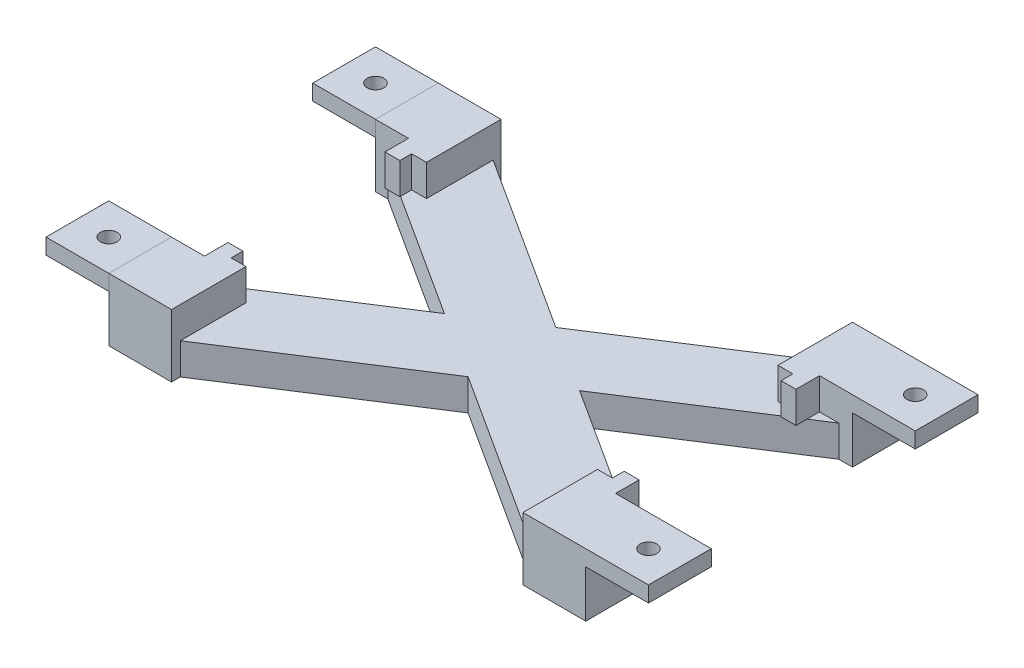
from build123d import *

# Parameters (mm, degrees)
SKETCH1_W                           = 20
SKETCH1_H                           = 20
BOSS_EXTRUDE1_DEPTH                 = 10
BOSS_EXTRUDE1_2_DEPTH               = 10
BOSS_EXTRUDE1_3_DEPTH               = 10
BOSS_EXTRUDE1_4_DEPTH               = 10
SKETCH1_3_W                         = 20
SKETCH1_3_H                         = 20
BOSS_EXTRUDE2_DEPTH                 = 10
BOSS_EXTRUDE3_DEPTH                 = 10
SKETCH3_W                           = 20
SKETCH3_H                           = 5
BOSS_EXTRUDE4_DEPTH                 = 20
BOSS_EXTRUDE4_2_DEPTH               = 20
BOSS_EXTRUDE6_DEPTH                 = 10
SKETCH10_W                          = 2.6543
SKETCH10_H                          = 20
F_4_0_209_DIAMETER_HOLE1_AT_2_COUNT = 2
F_4_0_209_DIAMETER_HOLE1_AT_2_PITCH = 172
F_4_0_209_DIAMETER_HOLE1_AT_3_COUNT = 2
F_4_0_209_DIAMETER_HOLE1_AT_3_PITCH = 191.85671737
F_4_0_209_DIAMETER_HOLE1_AT_4_COUNT = 2
F_4_0_209_DIAMETER_HOLE1_AT_4_PITCH = 85


with BuildPart() as part:
    # Sketch1 → Boss-Extrude1 (new body)
    with BuildSketch(Plane(origin=(0, 0, 0), x_dir=(1, 0, 0), z_dir=(0, 1, 0))):
        with Locations((-66, 42.5)):
            Rectangle(SKETCH1_W, SKETCH1_H)
    extrude(amount=BOSS_EXTRUDE1_DEPTH)



with BuildPart() as body_2:
    # Sketch1 → Boss-Extrude1 2 (new body)
    with BuildSketch(Plane(origin=(0, 0, 0), x_dir=(1, 0, 0), z_dir=(0, 1, 0))):
        with Locations((-66, -42.5)):
            Rectangle(SKETCH1_W, SKETCH1_H)
    extrude(amount=BOSS_EXTRUDE1_2_DEPTH)


with BuildPart() as body_3:
    # Sketch1 → Boss-Extrude1 3 (new body)
    with BuildSketch(Plane(origin=(0, 0, 0), x_dir=(1, 0, 0), z_dir=(0, 1, 0))):
        with Locations((66, -42.5)):
            Rectangle(SKETCH1_W, SKETCH1_H)
    extrude(amount=BOSS_EXTRUDE1_3_DEPTH)


with BuildPart() as body_4:
    # Sketch1 → Boss-Extrude1 4 (new body)
    with BuildSketch(Plane(origin=(0, 0, 0), x_dir=(1, 0, 0), z_dir=(0, 1, 0))):
        with Locations((66, 42.5)):
            Rectangle(SKETCH1_W, SKETCH1_H)
    extrude(amount=BOSS_EXTRUDE1_4_DEPTH)


with BuildPart() as part_1:
    add(part.part)

    add(body_2.part)  # Boss-Extrude2 merges body 2

    add(body_3.part)  # Boss-Extrude2 merges body 3

    add(body_4.part)  # Boss-Extrude2 merges body 4
    # Sketch1<3> → Boss-Extrude2 (add)
    with BuildSketch(Plane(origin=(0, 0, 0), x_dir=(1, 0, 0), z_dir=(0, 1, 0))):
        with Locations((-66, 42.5)):
            Rectangle(SKETCH1_3_W, SKETCH1_3_H)
        with Locations((-66, -42.5)):
            Rectangle(SKETCH1_3_W, SKETCH1_3_H)
        with Locations((66, -42.5)):
            Rectangle(SKETCH1_3_W, SKETCH1_3_H)
        with Locations((66, 42.5)):
            Rectangle(SKETCH1_3_W, SKETCH1_3_H)
    extrude(amount=-BOSS_EXTRUDE2_DEPTH)



with BuildPart() as body_2_2:
    # Sketch2 → Boss-Extrude3 (new body)
    with BuildSketch(Plane(origin=(0, 0, 0), x_dir=(1, 0, 0), z_dir=(0, 1, 0))):
        Polygon((-59.664368284, 52.338863371), (-72.335631716, 32.661136629), (-21.409556012, -0.132169696), (-72.215306836, -32.84799409), (-59.784693164, -52.15200591), (-0.205251763, -13.786456523), (59.664368284, -52.338863371), (72.335631716, -32.661136629), (21.409556012, 0.132169696), (72.215306836, 32.84799409), (59.784693164, 52.15200591), (0.205251763, 13.786456523), align=None)
    extrude(amount=-BOSS_EXTRUDE3_DEPTH)


with BuildPart() as body_3_2:
    # Sketch3 → Boss-Extrude4 (new body)
    with BuildSketch(Plane.ZY.offset(76)):
        with Locations((-42.5, 7.5)):
            Rectangle(SKETCH3_W, SKETCH3_H)
    boss_extrude4 = extrude(amount=BOSS_EXTRUDE4_DEPTH)

    # Sketch10 → #4 (0.209) Diameter Hole1 (revolve, cut)
    with BuildSketch(Plane(origin=(-86, 10, -42.5), x_dir=(0, 0, 1), z_dir=(1, 0, 0))):
        with Locations((1.32715, 10)):
            Rectangle(SKETCH10_W, SKETCH10_H)
    f_4_0_209_diameter_hole1 = revolve(axis=Axis((-86, 16.35, -42.5), (0, -1, 0)), mode=Mode.SUBTRACT)


with BuildPart() as body_4_2:
    # Sketch3 → Boss-Extrude4 2 (new body)
    with BuildSketch(Plane.ZY.offset(76)):
        with Locations((42.5, 7.5)):
            Rectangle(SKETCH3_W, SKETCH3_H)
    boss_extrude4_2 = extrude(amount=BOSS_EXTRUDE4_2_DEPTH)

    # #4 (0.209) Diameter Hole1 at 4: #4 (0.209) Diameter Hole1 ×2
    with Locations(*[(0, 0, i * F_4_0_209_DIAMETER_HOLE1_AT_4_PITCH) for i in range(1, F_4_0_209_DIAMETER_HOLE1_AT_4_COUNT)]):
        add(f_4_0_209_diameter_hole1, mode=Mode.SUBTRACT)


with BuildPart() as part_2:
    add(part_1.part)

    add(body_2_2.part)  # Boss-Extrude6 merges body 2 2
    # Sketch8 → Boss-Extrude6 (add)
    with BuildSketch(Plane(origin=(0, 0, 0), x_dir=(1, 0, 0), z_dir=(0, 1, 0))):
        Polygon((-65.5, 32.5), (-65.5, 25), (-60.75, 25), (-60.75, 28.75), (-56, 28.75), (-56, 32.5), align=None)
        Polygon((60.75, 25), (65.5, 25), (65.5, 32.5), (56, 32.5), (56, 28.75), (60.75, 28.75), align=None)
        Polygon((65.5, -32.5), (65.5, -25), (60.75, -25), (60.75, -28.75), (56, -28.75), (56, -32.5), align=None)
        Polygon((-60.75, -25), (-65.5, -25), (-65.5, -32.5), (-56, -32.5), (-56, -28.75), (-60.75, -28.75), align=None)
    extrude(amount=BOSS_EXTRUDE6_DEPTH)

    # Mirror1: Boss-Extrude4, Boss-Extrude4 2 across plane
    add(boss_extrude4.mirror(Plane(origin=(0, 0, 0), x_dir=(0, 0, 1), z_dir=(1, 0, 0))))
    add(boss_extrude4_2.mirror(Plane(origin=(0, 0, 0), x_dir=(0, 0, 1), z_dir=(1, 0, 0))))

    # #4 (0.209) Diameter Hole1 at 2: #4 (0.209) Diameter Hole1 ×2
    with Locations(*[(i * F_4_0_209_DIAMETER_HOLE1_AT_2_PITCH, 0, 0) for i in range(1, F_4_0_209_DIAMETER_HOLE1_AT_2_COUNT)]):
        add(f_4_0_209_diameter_hole1, mode=Mode.SUBTRACT)

    # #4 (0.209) Diameter Hole1 at 3: #4 (0.209) Diameter Hole1 ×2
    with Locations(*[Vector(0.8965023604999744, 0, 0.44303895722382464) * (i * F_4_0_209_DIAMETER_HOLE1_AT_3_PITCH) for i in range(1, F_4_0_209_DIAMETER_HOLE1_AT_3_COUNT)]):
        add(f_4_0_209_diameter_hole1, mode=Mode.SUBTRACT)


solid = Compound([body_3_2.part, body_4_2.part, part_2.part])
